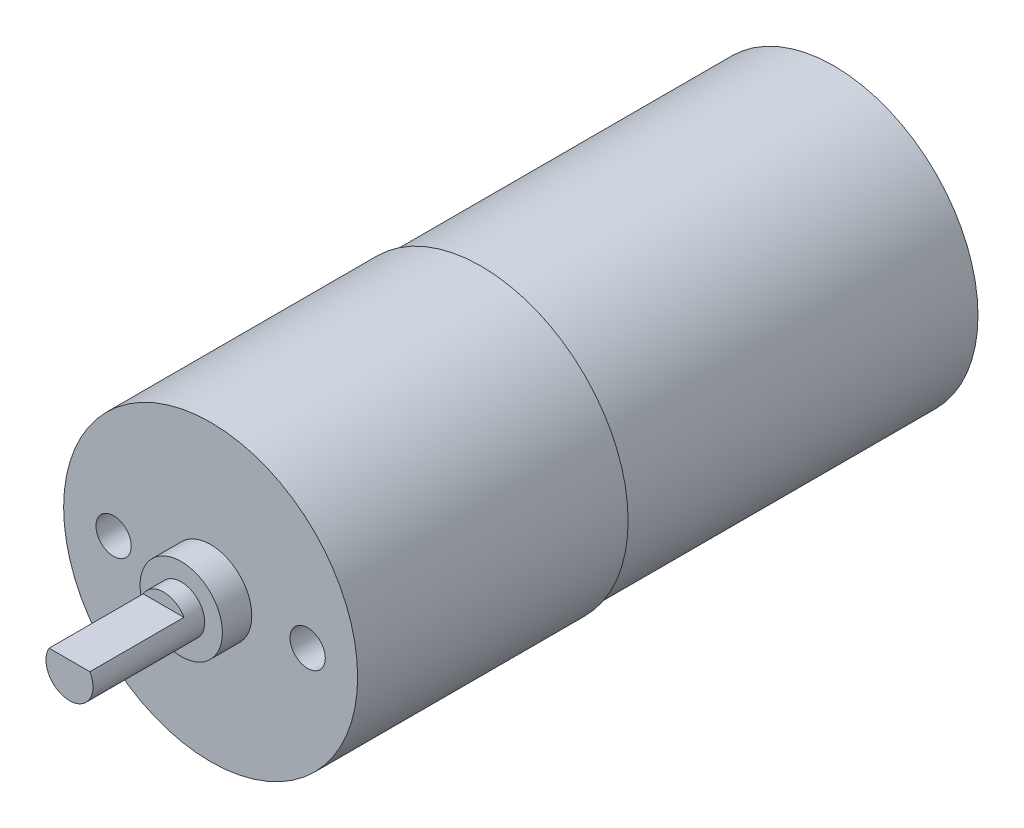
from build123d import *

# Parameters (mm, degrees)
SKETCH1_R           = 12.25
BOSS_EXTRUDE1_DEPTH = 30
SKETCH2_R           = 12.5
BOSS_EXTRUDE2_DEPTH = 23
CUT_EXTRUDE1_DEPTH  = 5
SKETCH3_R           = 3.5
BOSS_EXTRUDE3_DEPTH = 2.5
SKETCH4_R           = 2
BOSS_EXTRUDE4_DEPTH = 1.5
BOSS_EXTRUDE5_DEPTH = 8
SKETCH6_R           = 3.75
BOSS_EXTRUDE6_DEPTH = 2
FILLET1_R           = 1


with BuildPart() as part:
    # Sketch1 → Boss-Extrude1 (new body)
    with BuildSketch(Plane.XY):
        Circle(SKETCH1_R)
    extrude(amount=BOSS_EXTRUDE1_DEPTH)

    # Sketch2 → Boss-Extrude2 (add)
    with BuildSketch(Plane.XY.offset(30)):
        Circle(SKETCH2_R)
    extrude(amount=BOSS_EXTRUDE2_DEPTH)

    # Sketch7 → Cut-Extrude1 (cut)
    with BuildSketch(Plane.XY.offset(53)):
        with BuildLine():
            ThreePointArc((-9.75, 0), (-8.25, -1.5), (-6.75, 0))
            Line((-6.75, 0), (-8.25, 0))
            Line((-8.25, 0), (-9.75, 0))
        make_face()
        with BuildLine():
            Line((-8.25, 0), (-6.75, 0))
            ThreePointArc((-6.75, 0), (-8.25, 1.5), (-9.75, 0))
            Line((-9.75, 0), (-8.25, 0))
        make_face()
        with BuildLine():
            ThreePointArc((6.75, 0), (8.25, -1.5), (9.75, 0))
            Line((9.75, 0), (8.25, 0))
            Line((8.25, 0), (6.75, 0))
        make_face()
        with BuildLine():
            Line((8.25, 0), (9.75, 0))
            ThreePointArc((9.75, 0), (8.25, 1.5), (6.75, 0))
            Line((6.75, 0), (8.25, 0))
        make_face()
    extrude(amount=-CUT_EXTRUDE1_DEPTH, mode=Mode.SUBTRACT)

    # Sketch3 → Boss-Extrude3 (add)
    with BuildSketch(Plane.XY.offset(53)):
        Circle(SKETCH3_R)
    extrude(amount=BOSS_EXTRUDE3_DEPTH)

    # Sketch4 → Boss-Extrude4 (add)
    with BuildSketch(Plane.XY.offset(55.5)):
        Circle(SKETCH4_R)
    extrude(amount=BOSS_EXTRUDE4_DEPTH)

    # Sketch5 → Boss-Extrude5 (add)
    with BuildSketch(Plane.XY.offset(57)):
        with BuildLine():
            Line((1.732050808, 1), (-1.732050808, 1))
            ThreePointArc((-1.732050808, 1), (-0.51763809, -1.931851653), (2, 0))
            ThreePointArc((2, 0), (1.931851653, 0.51763809), (1.732050808, 1))
        make_face()
    extrude(amount=BOSS_EXTRUDE5_DEPTH)

    # Sketch6 → Boss-Extrude6 (add)
    with BuildSketch(Plane(origin=(0, 0, 0), x_dir=(-1, 0, 0), z_dir=(0, 0, -1))):
        with Locations(Location((0, 0, 0), (0, 0, 180))):
            Circle(SKETCH6_R)
    extrude(amount=BOSS_EXTRUDE6_DEPTH)

    # Fillet1
    fillet1_edges = [part.edges().sort_by_distance(p)[0] for p in [
        (-3.75, 0, -2),
    ]]
    fillet(fillet1_edges, radius=FILLET1_R)


solid = part.part
